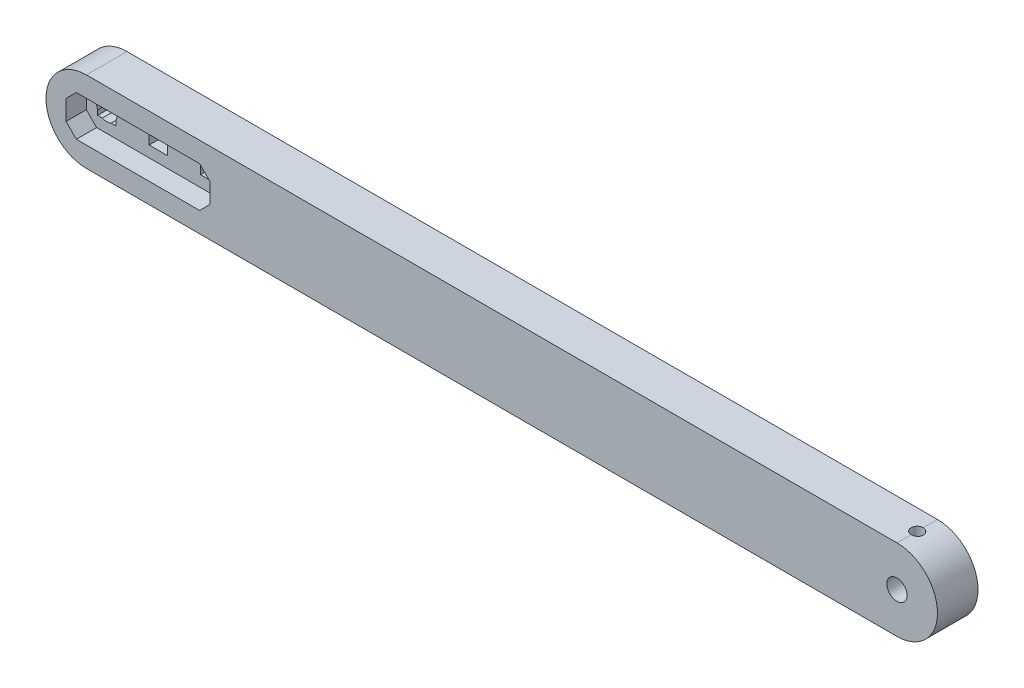
from build123d import *

# Parameters (mm, degrees)
SKETCH1_R           = 2.5
BOSS_EXTRUDE1_DEPTH = 10
SKETCH1_4_W         = 4.5
SKETCH1_4_H         = 4.5
BOSS_EXTRUDE2_DEPTH = 5
CUT_EXTRUDE1_REACH  = 114.25
SKETCH2_R           = 1.5


with BuildPart() as part:
    # Sketch1 → Boss-Extrude1 (new body)
    with BuildSketch(Plane.XY):
        with BuildLine():
            Line((100, 10), (-100, 10))
            ThreePointArc((-100, 10), (-110, 0), (-100, -10))
            Line((-100, -10), (100, -10))
            ThreePointArc((100, -10), (110, 0), (100, 10))
        make_face()
        Polygon((-69.55, -2.46), (-72.09, -5), (-102.51, -5), (-105.05, -2.46), (-105.05, 2.46), (-102.51, 5), (-72.09, 5), (-69.55, 2.46), align=None, mode=Mode.SUBTRACT)
        with Locations((100, 0)):
            Circle(SKETCH1_R, mode=Mode.SUBTRACT)
    extrude(amount=BOSS_EXTRUDE1_DEPTH)

    # Sketch1<4> → Boss-Extrude2 (add)
    with BuildSketch(Plane.XY):
        Polygon((-102.51, -5), (-72.09, -5), (-69.55, -2.46), (-69.55, 2.46), (-72.09, 5), (-102.51, 5), (-105.05, 2.46), (-105.05, -2.46), align=None)
        with BuildLine():
            Line((-98.910275264, 2.25), (-97.75, 2.25))
            Line((-97.75, 2.25), (-97.75, 1.089724736))
            ThreePointArc((-97.75, 1.089724736), (-97.563301414, 0.559016994), (-97.5, 0))
            ThreePointArc((-97.5, 0), (-97.563301414, -0.559016994), (-97.75, -1.089724736))
            Line((-97.75, -1.089724736), (-97.75, -2.25))
            Line((-97.75, -2.25), (-98.910275264, -2.25))
            ThreePointArc((-98.910275264, -2.25), (-100, -2.5), (-101.089724736, -2.25))
            Line((-101.089724736, -2.25), (-102.25, -2.25))
            Line((-102.25, -2.25), (-102.25, -1.089724736))
            ThreePointArc((-102.25, -1.089724736), (-102.5, 0), (-102.25, 1.089724736))
            Line((-102.25, 1.089724736), (-102.25, 2.25))
            Line((-102.25, 2.25), (-101.089724736, 2.25))
            ThreePointArc((-101.089724736, 2.25), (-100, 2.5), (-98.910275264, 2.25))
        make_face(mode=Mode.SUBTRACT)
        with Locations((-87.3, 0)):
            Rectangle(SKETCH1_4_W, SKETCH1_4_H, mode=Mode.SUBTRACT)
        with Locations((-74.6, 0)):
            Rectangle(SKETCH1_4_W, SKETCH1_4_H, mode=Mode.SUBTRACT)
    extrude(amount=BOSS_EXTRUDE2_DEPTH)

    # Sketch2 → Cut-Extrude1 (cut, up to next)
    with BuildSketch(Plane(origin=(0, 10, 0), x_dir=(1, 0, 0), z_dir=(0, 1, 0)), mode=Mode.PRIVATE) as cut_extrude1_sk1:
        with Locations((100, -5)):
            Circle(SKETCH2_R)
    cut_extrude1_tool1 = extrude(cut_extrude1_sk1.sketch, amount=-CUT_EXTRUDE1_REACH, mode=Mode.PRIVATE) & part.part
    add(cut_extrude1_tool1.solids().sort_by_distance((100, 10, 5))[0], mode=Mode.SUBTRACT)


solid = part.part
